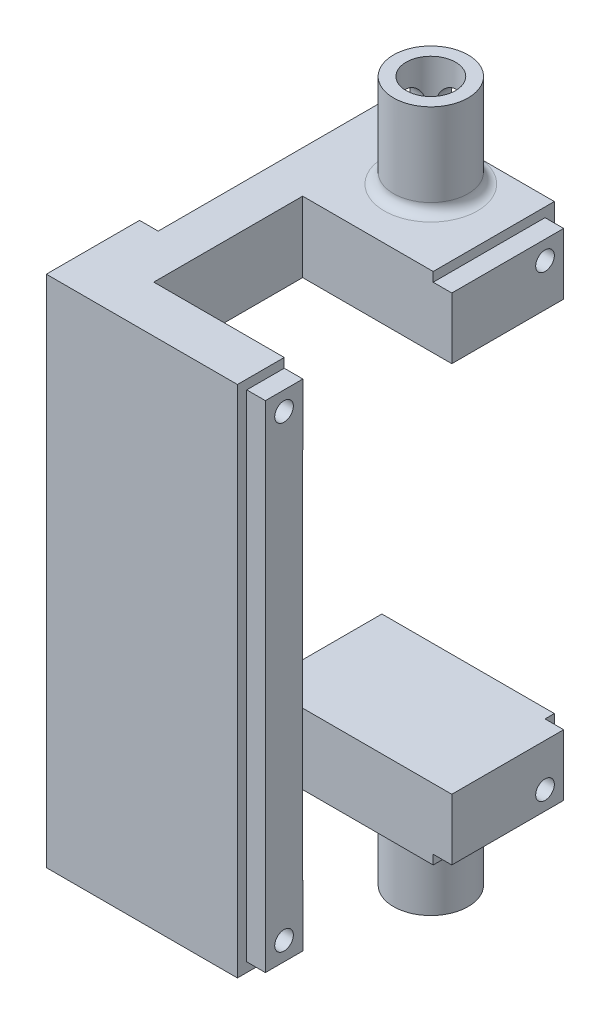
from build123d import *

# Parameters (mm, degrees)
SKETCH_1_R           = 2.000000000000001
EXTRUDE_1_DEPTH      = 29
SKETCH_2_W           = 20.5
SKETCH_2_H           = 70.28340969233892
EXTRUDE_2_DEPTH      = 3
SKETCH_3_W           = 20.5
SKETCH_3_H           = 7.570852423084727
CUT_EXTRUDE_1_DEPTH  = 49.62100286394029
SKETCH_5_R           = 2.5
EXTRUDE_3_DEPTH      = 10
CUT_EXTRUDE_2_REACH  = 75.297
SKETCH_8_R           = 1.6000000000000003
SKETCH_9_W           = 20.5
SKETCH_9_H           = 32
CUT_EXTRUDE_3_DEPTH  = 65.57298284377197
SKETCH_12_W          = 20.499999999999996
SKETCH_12_H          = 7.57085242308473
SKETCH_12_R          = 2.0000000000000018
SKETCH_12_R_2        = 2.000000000000001
EXTRUDE_5_DEPTH      = 30
EXTRUDE_6_DEPTH      = 10
SKETCH_16_R          = 1.5000000000000004
CUT_EXTRUDE_5_DEPTH  = 48.388093987806805
SKETCH_17_R          = 1.5000000000000004
CUT_EXTRUDE_6_DEPTH  = 51.404676958704755
EXTRUDE_START        = 10
SKETCH_19_R          = 4
SKETCH_19_R_2        = 2.5000000000000004
EXTRUDE_7_DEPTH      = 10
SKETCH_21_R          = 1.5000000000000004
CUT_EXTRUDE_7_DEPTH  = 48.38809406709012
SKETCH_22_R          = 1.5000000000000004
CUT_EXTRUDE_8_DEPTH  = 51.404676958704755
SKETCH_23_W          = 20.5
SKETCH_23_H          = 55.141704846169446
EXTRUDE_8_DEPTH      = 2
EXTRUDE_9_DEPTH      = 2
CUT_EXTRUDE_9_DEPTH  = 16
EXTRUDE_START_2      = 20
SKETCH_26_R          = 2.000000000000003
SKETCH_26_R_2        = 2.000000000000001
SKETCH_26_R_3        = 2.000000000000002
EXTRUDE_10_DEPTH     = 20
SKETCH_27_W          = 16
SKETCH_27_H          = 8.000000000000007
CUT_EXTRUDE_10_DEPTH = 75.49499461906014
SKETCH_29_W          = 34
SKETCH_29_H          = 55.14170484616947
CUT_EXTRUDE_11_DEPTH = 2
SKETCH_32_W          = 3.9768627953179667
SKETCH_32_H          = 6.57085242308473
CUT_EXTRUDE_13_DEPTH = 16
SKETCH_33_R          = 1.0000000000000018
CUT_EXTRUDE_14_DEPTH = 16
SKETCH_35_R          = 1.0000000000000004
CUT_EXTRUDE_15_DEPTH = 5
SKETCH_36_R          = 2.65
CUT_EXTRUDE_16_DEPTH = 10
CUT_EXTRUDE_START    = -10
SKETCH_37_R          = 2.65
CUT_EXTRUDE_17_DEPTH = 10


with BuildPart() as part:
    # 草图1 → 凸台-拉伸1 (new body)
    # profile 1 of 3: a face of its own
    with BuildSketch(Plane.XY):
        with BuildLine():
            Line((-10.250000000000004, 35.14170484616946), (-10.250000000000004, 20))
            Line((-10.25, 20.000000000000004), (-4.999999999999999, 20.000000000000004))
            Line((-4.999999999999999, 20.000000000000004), (-4.999999999999999, 23.000000000000004))
            ThreePointArc((-5.000000000000001, 23.000000000000004), (-6.414213562373094, 26.4142135623731), (-2.9999999999999982, 25.000000000000004))
            Line((-2.9999999999999982, 25.000000000000004), (3, 25.000000000000004))
            ThreePointArc((3, 25.000000000000004), (5.000000000000001, 27.000000000000004), (7.000000000000002, 25.000000000000004))
            ThreePointArc((7.000000000000002, 25.000000000000004), (6.414213562373095, 23.585786437626908), (4.999999999999999, 23.000000000000004))
            Line((5.000000000000001, 23.000000000000004), (5.000000000000001, 20.000000000000004))
            Line((5, 20.000000000000004), (10.249999999999996, 20.000000000000004))
            Line((10.249999999999996, 20), (10.249999999999996, 35.14170484616946))
            Line((10.249999999999996, 35.14170484616946), (-10.250000000000004, 35.14170484616946))
        make_face()
    # profile 2 of 3: a face of its own
    with BuildSketch(Plane.XY):
        Polygon((10.249999999999996, -20), (-10.25, -20), (-10.250000000000004, -35.14170484616946), (10.249999999999996, -35.14170484616946), align=None)
        with Locations(Location((-4.999999999999999, -25.000000000000004, 0), (0, 0, 180))):
            Circle(SKETCH_1_R, mode=Mode.SUBTRACT)
        with Locations(Location((5.000000000000001, -25.000000000000004, 0), (0, 0, 180))):
            Circle(SKETCH_1_R, mode=Mode.SUBTRACT)
    # profile 3 of 3: a face of its own
    with BuildSketch(Plane.XY):
        with BuildLine():
            Line((-4.999999999999999, 23.000000000000004), (-4.999999999999999, 20.000000000000004))
            Line((-4.999999999999999, 20.000000000000004), (5, 20.000000000000004))
            Line((5.000000000000001, 20.000000000000004), (5.000000000000001, 23.000000000000004))
            ThreePointArc((4.999999999999999, 23.000000000000004), (3.585786437626904, 23.585786437626908), (3, 25.000000000000004))
            Line((3, 25.000000000000004), (-2.9999999999999982, 25.000000000000004))
            ThreePointArc((-2.9999999999999982, 25.000000000000004), (-3.585786437626905, 23.585786437626908), (-5.000000000000001, 23.000000000000004))
        make_face()
    extrude(amount=EXTRUDE_1_DEPTH)

    # 草图2 → 凸台-拉伸2 (add)
    with BuildSketch(Plane.XY.offset(29)):
        Rectangle(SKETCH_2_W, SKETCH_2_H)
    extrude(amount=EXTRUDE_2_DEPTH)

    # 草图3 → 切除-拉伸1 (cut, through all)
    with BuildSketch(Plane(origin=(0, 0, 0), x_dir=(-1, 0, 0), z_dir=(0, 0, -1))):
        with Locations((3.55e-15, -31.356278634627095)):
            Rectangle(SKETCH_3_W, SKETCH_3_H)
        Polygon((-10.249999999999996, 35.14170484616946), (-10.249999999999996, 27.57085242308473), (10.250000000000004, 27.570852423084734), (10.250000000000004, 35.14170484616946), align=None)
    extrude(amount=-CUT_EXTRUDE_1_DEPTH, mode=Mode.SUBTRACT)

    # 草图5 → 凸台-拉伸3 (add)
    with BuildSketch(Plane.XZ.offset(27.570852423084734)):
        with Locations(Location((0, 2.5, 0), (0, 0, 270))):
            Circle(SKETCH_5_R)
    extrude(amount=EXTRUDE_3_DEPTH)

    # 草图8 → 切除-拉伸2 (cut, up to next)
    with BuildSketch(Plane(origin=(0, 27.570852423084734, 0), x_dir=(1, 0, 0), z_dir=(0, 1, 0)), mode=Mode.PRIVATE) as cut_extrude_2_sk1:
        with Locations(Location((1.71e-15, -16.5, 0), (0, 0, 270))):
            Circle(SKETCH_8_R)
    cut_extrude_2_tool1 = extrude(cut_extrude_2_sk1.sketch, amount=-CUT_EXTRUDE_2_REACH, mode=Mode.PRIVATE) & part.part
    # 草图8 → 切除-拉伸2 (cut, up to next)
    with BuildSketch(Plane(origin=(0, 27.570852423084734, 0), x_dir=(1, 0, 0), z_dir=(0, 1, 0)), mode=Mode.PRIVATE) as cut_extrude_2_sk2:
        with Locations(Location((1.22e-15, -26.500000000000004, 0), (0, 0, 270))):
            Circle(SKETCH_8_R)
    cut_extrude_2_tool2 = extrude(cut_extrude_2_sk2.sketch, amount=-CUT_EXTRUDE_2_REACH, mode=Mode.PRIVATE) & part.part
    add(cut_extrude_2_tool1.solids().sort_by_distance((0, 27.570852, 16.5))[0], mode=Mode.SUBTRACT)
    add(cut_extrude_2_tool2.solids().sort_by_distance((0, 27.570852, 26.5))[0], mode=Mode.SUBTRACT)

    # 草图9 → 切除-拉伸3 (cut, through all)
    with BuildSketch(Plane.XZ.offset(27.570852423084734)):
        with Locations((-3.55e-15, 16)):
            Rectangle(SKETCH_9_W, SKETCH_9_H)
    extrude(amount=CUT_EXTRUDE_3_DEPTH, mode=Mode.SUBTRACT)

    # 草图12 → 凸台-拉伸5 (add)
    with BuildSketch(Plane(origin=(0, 0, 0), x_dir=(-1, 0, 0), z_dir=(0, 0, -1))):
        with Locations((1.78e-15, 23.78542621154237)):
            Rectangle(SKETCH_12_W, SKETCH_12_H)
        with Locations((-5.000000000000001, 25.000000000000004)):
            Circle(SKETCH_12_R, mode=Mode.SUBTRACT)
        with Locations((4.999999999999999, 25.000000000000004)):
            Circle(SKETCH_12_R_2, mode=Mode.SUBTRACT)
    extrude(amount=-EXTRUDE_5_DEPTH)

    # 草图13 → 凸台-拉伸6 (add)
    with BuildSketch(Plane(origin=(0, 27.570852423084734, 0), x_dir=(1, 0, 0), z_dir=(0, 1, 0))):
        with BuildLine():
            ThreePointArc((4.456e-14, -7.5), (-2.5, -5.000000000000058), (-7.084e-14, -2.4999999999999996))
            Line((-1.4e-16, -2.4999999999999996), (-5e-17, -1))
            ThreePointArc((7.635e-14, -1), (-3.9999999999999996, -4.999999999999907), (-1.067e-13, -9))
            Line((-4.9e-16, -9), (-4.1e-16, -7.5))
        make_face()
        with BuildLine():
            Line((-5e-17, -1), (-1.4e-16, -2.4999999999999996))
            ThreePointArc((-7.084e-14, -2.4999999999999996), (1.7677669529663447, -3.2322330470336054), (2.500000000000001, -5))
            ThreePointArc((2.500000000000001, -5.000000000000001), (1.767766952966385, -6.767766952966354), (4.456e-14, -7.5))
            Line((-4.1e-16, -7.5), (-4.9e-16, -9))
            ThreePointArc((-1.067e-13, -9), (2.828427124746152, -7.828427124746229), (4.000000000000001, -5.000000000000001))
            ThreePointArc((4.000000000000001, -5), (2.8284271247462174, -2.171572875253837), (7.635e-14, -1))
        make_face()
    extrude(amount=EXTRUDE_6_DEPTH)

    # 草图15 → 旋转1 (revolve)
    with BuildSketch(Plane(origin=(0, 0, 0), x_dir=(0, 0, -1), z_dir=(1, 0, 0))):
        with BuildLine():
            Line((-1, 27.570852423084734), (0, 27.570852423084734))
            ThreePointArc((0, 27.570852423084734), (-0.7128919117369903, 27.930797461014013), (-1, 28.676011694509246))
            Line((-1, 28.676011694509246), (-1, 27.570852423084734))
        make_face()
    revolve(axis=Axis((0, -962.4291475769152, 4.99999999999657), (0, 1, 3.43e-15)))

    # 草图16 → 切除-拉伸5 (cut, through all)
    with BuildSketch(Plane.XY.offset(5)):
        with Locations(Location((4.9e-16, 33.57085242308473, 0), (0, 0, 90))):
            Circle(SKETCH_16_R)
    extrude(amount=-CUT_EXTRUDE_5_DEPTH, mode=Mode.SUBTRACT)

    # 草图17 → 切除-拉伸6 (cut, through all)
    with BuildSketch(Plane(origin=(0, 0, 0), x_dir=(0, 0, -1), z_dir=(1, 0, 0))):
        with Locations((-5, 33.57085242308473)):
            Circle(SKETCH_17_R)
    extrude(amount=-CUT_EXTRUDE_6_DEPTH, mode=Mode.SUBTRACT)

    # 草图19 → 凸台-拉伸7 (add)
    with BuildSketch(Plane.XZ.offset(27.570852423084734).offset(EXTRUDE_START)):
        with Locations(Location((0, 4.999999999999998, 0), (0, 0, 270))):
            Circle(SKETCH_19_R)
        with Locations(Location((0, 4.999999999999998, 0), (0, 0, 90))):
            Circle(SKETCH_19_R_2, mode=Mode.SUBTRACT)
    extrude(amount=-EXTRUDE_7_DEPTH)

    # 草图20 → 旋转2 (revolve)
    with BuildSketch(Plane(origin=(0, 0, 0), x_dir=(0, 0, -1), z_dir=(1, 0, 0))):
        with BuildLine():
            Line((-0.9999999999999983, -27.570852423084734), (0, -27.570852423084734))
            ThreePointArc((0, -27.570852423084734), (-0.7071067811865462, -27.863745641898188), (-0.9999999999999981, -28.570852423084734))
            Line((-0.9999999999999981, -28.570852423084734), (-0.9999999999999983, -27.570852423084734))
        make_face()
    revolve(axis=Axis((0, -1027.5708524230847, 4.999999999996567), (0, 1, 3.43e-15)))

    # 草图21 → 切除-拉伸7 (cut, through all)
    with BuildSketch(Plane.XY.offset(5)):
        with Locations((0, -33.57085242308473)):
            Circle(SKETCH_21_R)
    extrude(amount=-CUT_EXTRUDE_7_DEPTH, mode=Mode.SUBTRACT)

    # 草图22 → 切除-拉伸8 (cut, through all)
    with BuildSketch(Plane(origin=(0, 0, 0), x_dir=(0, 0, -1), z_dir=(1, 0, 0))):
        with Locations((-5, -33.57085242308473)):
            Circle(SKETCH_22_R)
    extrude(amount=-CUT_EXTRUDE_8_DEPTH, mode=Mode.SUBTRACT)

    # 草图23 → 凸台-拉伸8 (add)
    with BuildSketch(Plane.XY.offset(32)):
        Rectangle(SKETCH_23_W, SKETCH_23_H)
    extrude(amount=EXTRUDE_8_DEPTH)

    # 草图24 → 凸台-拉伸9 (add)
    with BuildSketch(Plane.ZY.offset(10.250000000000004)):
        Polygon((34, 27.570852423084734), (24, 27.570852423084734), (24.000000000000007, -27.570852423084713), (34, -27.57085242308472), align=None)
    extrude(amount=EXTRUDE_9_DEPTH)

    # 草图25 → 切除-拉伸9 (cut)
    with BuildSketch(Plane(origin=(10.249999999999996, 0, 0), x_dir=(0, 0, -1), z_dir=(1, 0, 0))):
        Polygon((-17, -20), (-25.000000000000004, -20), (-25.000000000000004, -27.570852423084713), (-17, -27.570852423084723), align=None)
        Polygon((-21.000000000000004, 27.570852423084734), (-25.000000000000004, 27.570852423084734), (-25.000000000000004, 20.000000000000004), (-17.000000000000004, 20.000000000000004), (-17.000000000000004, 27.570852423084734), align=None)
    extrude(amount=-CUT_EXTRUDE_9_DEPTH, mode=Mode.SUBTRACT)

    # 草图26 → 凸台-拉伸10 (add)
    with BuildSketch(Plane(origin=(0, 0, 29), x_dir=(-1, 0, 0), z_dir=(0, 0, -1)).offset(EXTRUDE_START_2)):
        with Locations((-5.000000000000001, 25.000000000000004)):
            Circle(SKETCH_26_R)
        with Locations((4.999999999999999, 25.000000000000004)):
            Circle(SKETCH_26_R_2)
        with Locations((-5.000000000000001, -25.000000000000004)):
            Circle(SKETCH_26_R_3)
        with Locations((4.999999999999999, -25.000000000000004)):
            Circle(SKETCH_26_R_2)
    extrude(amount=-EXTRUDE_10_DEPTH)

    # 草图27 → 切除-拉伸10 (cut, through all)
    with BuildSketch(Plane.XZ.offset(27.570852423084734)):
        with Locations((2.2499999999999964, 21.000000000000004)):
            Rectangle(SKETCH_27_W, SKETCH_27_H)
    extrude(amount=-CUT_EXTRUDE_10_DEPTH, mode=Mode.SUBTRACT)

    # 草图29 → 切除-拉伸11 (cut)
    with BuildSketch(Plane(origin=(10.249999999999996, 0, 0), x_dir=(0, 0, -1), z_dir=(1, 0, 0))):
        with Locations((-17, 0)):
            Rectangle(SKETCH_29_W, SKETCH_29_H)
        Polygon((-33, 26.570852423084734), (-33, -26.570852423084734), (-1, -26.570852423084734), (-1.0000000000000009, 26.570852423084734), align=None, mode=Mode.SUBTRACT)
    extrude(amount=-CUT_EXTRUDE_11_DEPTH, mode=Mode.SUBTRACT)

    # 草图32 → 切除-拉伸13 (cut)
    with BuildSketch(Plane(origin=(10.249999999999996, 0, 0), x_dir=(0, 0, -1), z_dir=(1, 0, 0))):
        Polygon((-13, 26.570852423084734), (-25.000000000000004, 26.570852423084734), (-25.000000000000004, 20.000000000000004), (-28.97686279531797, 20.000000000000004), (-28.97686279531797, -19.999999999999996), (-25.000000000000004, -20), (-25.000000000000004, -26.570852423084734), (-12.999999999999993, -26.570852423084734), align=None)
        with Locations((-26.988431397658985, 23.28542621154237)):
            Rectangle(SKETCH_32_W, SKETCH_32_H)
        Polygon((-28.97686279531797, -19.999999999999996), (-28.97686279531797, -26.570852423084734), (-25.000000000000004, -26.570852423084734), (-25.000000000000004, -20), align=None)
        Polygon((-25.000000000000004, -26.570852423084734), (-28.97686279531797, -26.570852423084734), (-28.97686279531797, -27.59191586273335), (-12.999999999999995, -27.59191586273335), (-12.999999999999995, -26.57085242308473), align=None)
        Polygon((-28.97686279531797, 27.59388998719103), (-28.97686279531797, 26.570852423084734), (-25.000000000000004, 26.570852423084734), (-13, 26.570852423084734), (-12.999999999999995, 27.59388998719103), align=None)
    extrude(amount=-CUT_EXTRUDE_13_DEPTH, mode=Mode.SUBTRACT)

    # 草图33 → 切除-拉伸14 (cut)
    with BuildSketch(Plane(origin=(10.249999999999996, 0, 0), x_dir=(0, 0, -1), z_dir=(1, 0, 0))):
        with Locations((-31, 24.57085242308473)):
            Circle(SKETCH_33_R)
        with Locations((-31, -24.57085242308473)):
            Circle(SKETCH_33_R)
    extrude(amount=-CUT_EXTRUDE_14_DEPTH, mode=Mode.SUBTRACT)

    # 草图35 → 切除-拉伸15 (cut)
    with BuildSketch(Plane(origin=(10.249999999999996, 0, 0), x_dir=(0, 0, -1), z_dir=(1, 0, 0))):
        with Locations((-3.000000000000001, 24.57085242308473)):
            Circle(SKETCH_35_R)
        with Locations((-3, -24.57085242308473)):
            Circle(SKETCH_35_R)
    extrude(amount=-CUT_EXTRUDE_15_DEPTH, mode=Mode.SUBTRACT)

    # 草图36 → 切除-拉伸16 (cut)
    with BuildSketch(Plane.XZ.offset(37.57085242308474)):
        with Locations(Location((0, 4.999999999999998, 0), (0, 0, 270))):
            Circle(SKETCH_36_R)
    extrude(amount=-CUT_EXTRUDE_16_DEPTH, mode=Mode.SUBTRACT)

    # 草图37 → 切除-拉伸17 (cut)
    with BuildSketch(Plane(origin=(0, 37.57085242308474, 0), x_dir=(1, 0, 0), z_dir=(0, 1, 0)).offset(CUT_EXTRUDE_START)):
        with Locations(Location((0, -4.999999999999965, 0), (0, 0, 90))):
            Circle(SKETCH_37_R)
    extrude(amount=CUT_EXTRUDE_17_DEPTH, mode=Mode.SUBTRACT)


solid = part.part
